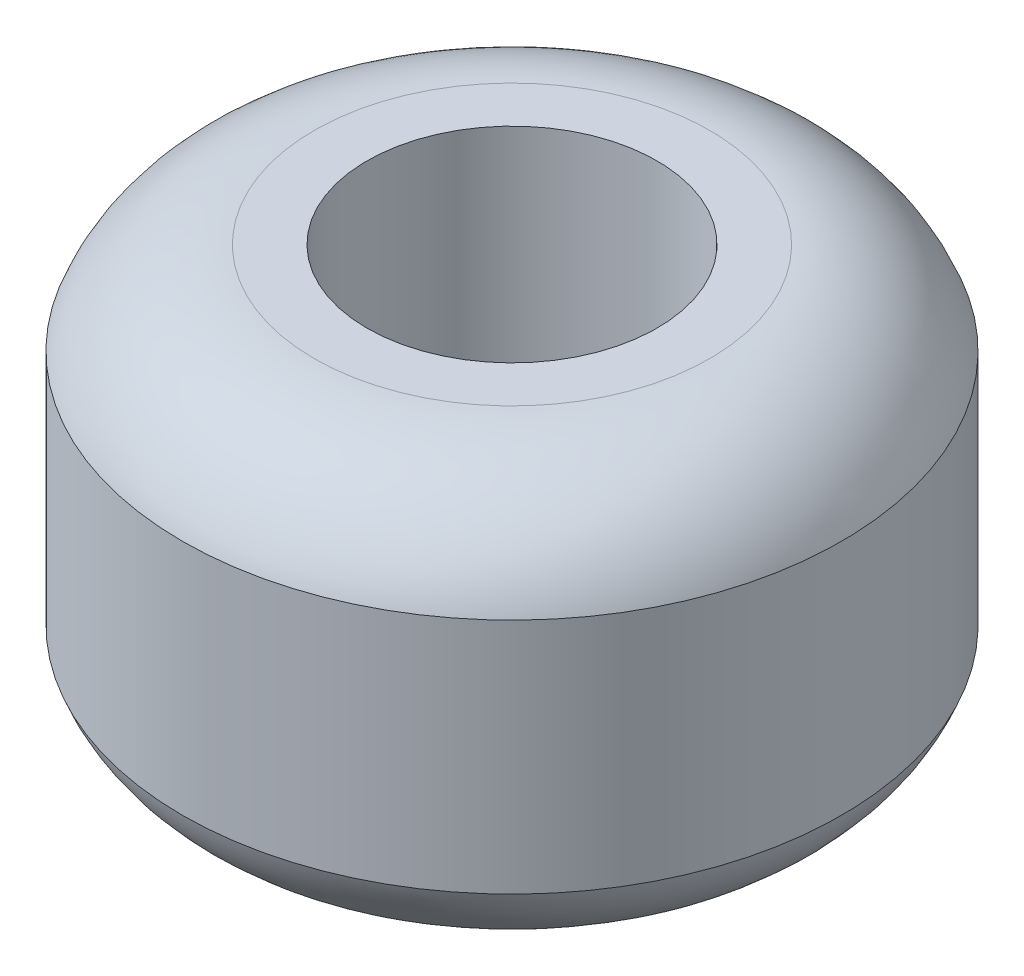
from build123d import *


with BuildPart() as part:
    # Sketch1 → Revolve1 (revolve)
    with BuildSketch(Plane.XY, mode=Mode.PRIVATE) as revolve1_sk:
        with BuildLine():
            Line((11, 16), (11, -16))
            Line((11, -16), (15, -16))
            ThreePointArc((15, -16), (21.103277808, -14.076111154), (25, -9))
            Line((25, -9), (25, 9))
            ThreePointArc((25, 9), (21.103277808, 14.076111154), (15, 16))
            Line((15, 16), (11, 16))
        make_face()
    revolve(revolve1_sk.sketch.rotate(Axis((0, 26.141894061, 0), (0, -1, 0)), 90), axis=Axis((0, 26.141894061, 0), (0, -1, 0)))


solid = part.part
